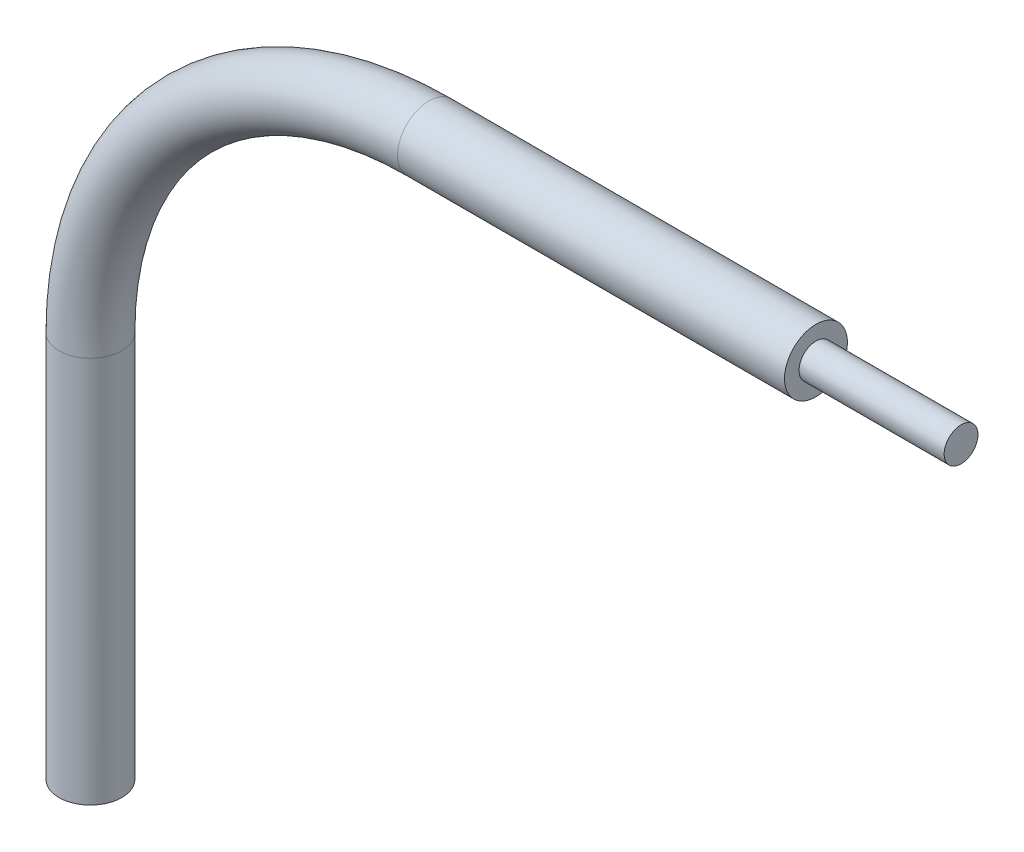
from build123d import *

# Parameters (mm, degrees)
SWEEP1_PROFILE_R    = 0.65
SKETCH9_R           = 0.35
BOSS_EXTRUDE1_DEPTH = 3


with BuildPart() as part:
    # Sweep1: sweep along a path in Sketch1
    with BuildLine(Plane.XY) as sweep1_path:
        Line((0, 0), (0, 8))
        ThreePointArc((0, 8), (2.050252532, 12.949747468), (7, 15))
        Line((7, 15), (15, 15))
    # Sweep1 profile (on start of the path) → Sweep1 (sweep)
    with BuildSketch(Plane.ZX):
        Circle(SWEEP1_PROFILE_R)
    sweep(path=sweep1_path.line)

    # Sketch9 → Boss-Extrude1 (add)
    with BuildSketch(Plane(origin=(15, 0, 0), x_dir=(0, 0, -1), z_dir=(1, 0, 0))):
        with Locations((0, 15)):
            Circle(SKETCH9_R)
    extrude(amount=BOSS_EXTRUDE1_DEPTH)


solid = part.part
